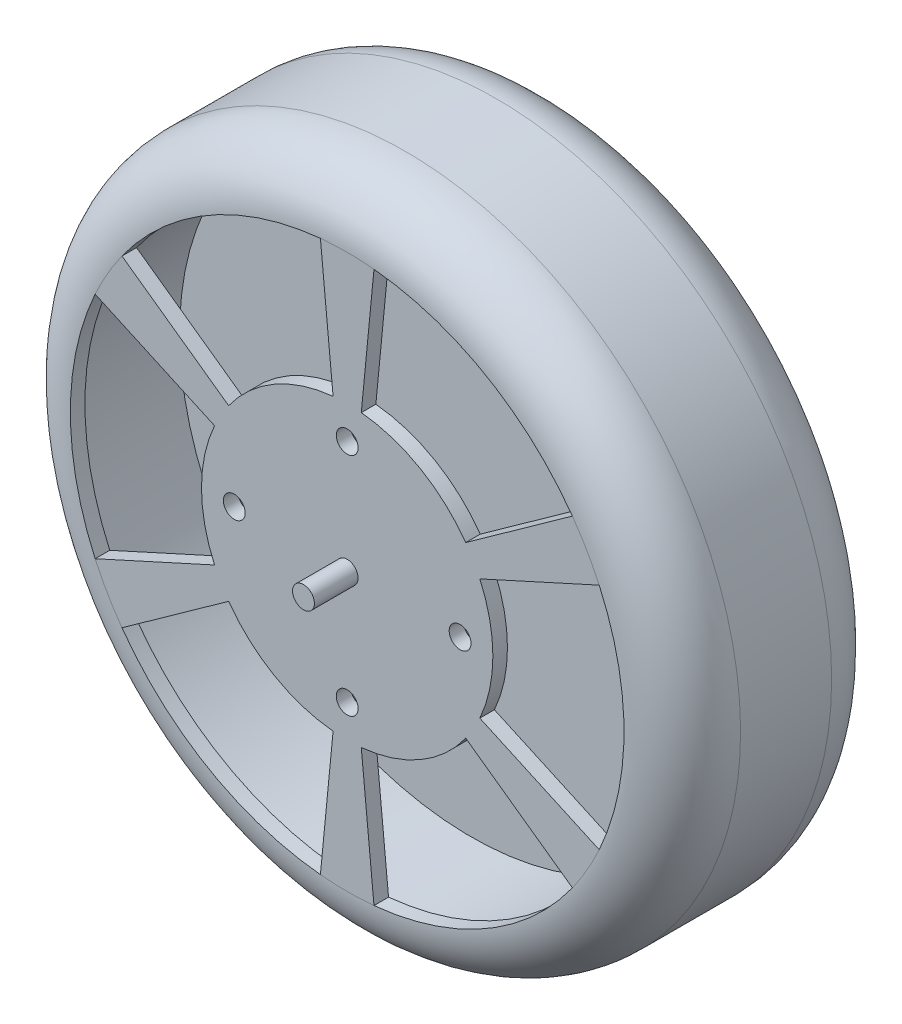
from build123d import *

# Parameters (mm, degrees)
SKETCH_1_R          = 46
EXTRUDE_1_DEPTH     = 28.5
FILLET_1_R          = 8
SKETCH_2_R          = 1.5
CUT_EXTRUDE_1_DEPTH = 4
SKETCH_3_R          = 1.5
EXTRUDE_2_DEPTH     = 6
SKETCH_5_R          = 2
CUT_EXTRUDE_2_DEPTH = 4
CUT_EXTRUDE_3_DEPTH = 12
SKETCH_7_W          = 40
SKETCH_7_H          = 15


with BuildPart() as part:
    # 草图1 → 凸台-拉伸1 (new body)
    with BuildSketch(Plane.XY):
        with Locations(Location((0, 0, 0), (0, 0, 180))):
            Circle(SKETCH_1_R)
    extrude(amount=EXTRUDE_1_DEPTH)

    # 圆角1
    fillet_1_edges = [part.edges().sort_by_distance(p)[0] for p in [
        (46, 0, 0),
        (46, 0, 28.5),
    ]]
    fillet(fillet_1_edges, radius=FILLET_1_R)

    # 草图2 → 切除-拉伸1 (cut)
    with BuildSketch(Plane.XY.offset(28.5)):
        with Locations((0, -15.5)):
            Circle(SKETCH_2_R)
        with Locations((-15.5, 0)):
            Circle(SKETCH_2_R)
        with Locations((0, 15.5)):
            Circle(SKETCH_2_R)
        with Locations((15.5, 0)):
            Circle(SKETCH_2_R)
    extrude(amount=-CUT_EXTRUDE_1_DEPTH, mode=Mode.SUBTRACT)

    # 草图3 → 凸台-拉伸2 (add)
    with BuildSketch(Plane.XY.offset(28.5)):
        Circle(SKETCH_3_R)
    extrude(amount=EXTRUDE_2_DEPTH)

    # 草图5 → 切除-拉伸2 (cut)
    with BuildSketch(Plane(origin=(0, 0, 0), x_dir=(-1, 0, 0), z_dir=(0, 0, -1))):
        with Locations((-20, 0)):
            Circle(SKETCH_5_R)
        with Locations((0, 20)):
            Circle(SKETCH_5_R)
        with Locations((20, 0)):
            Circle(SKETCH_5_R)
        with Locations((0, -20)):
            Circle(SKETCH_5_R)
    extrude(amount=-CUT_EXTRUDE_2_DEPTH, mode=Mode.SUBTRACT)

    # 草图6 → 切除-拉伸3 (cut)
    with BuildSketch(Plane.XY.offset(28.5)):
        with BuildLine():
            Line((-1.935483871, -19.906127252), (-3.677419355, -37.821641779))
            ThreePointArc((-3.677419355, -37.821641779), (-19, -32.908965344), (-30.915792916, -22.095559471))
            Line((-30.915792916, -22.095559471), (-16.271469956, -11.629241827))
            ThreePointArc((-16.271469956, -11.629241827), (-10, -17.320508076), (-1.935483871, -19.906127252))
        make_face()
        with BuildLine():
            Line((1.935483871, -19.906127252), (3.677419355, -37.821641779))
            ThreePointArc((3.677419355, -37.821641779), (19, -32.908965344), (30.915792916, -22.095559471))
            Line((30.915792916, -22.095559471), (16.271469956, -11.629241827))
            ThreePointArc((16.271469956, -11.629241827), (10, -17.320508076), (1.935483871, -19.906127252))
        make_face()
        with BuildLine():
            Line((-18.206953827, -8.276885425), (-34.593212271, -15.726082308))
            ThreePointArc((-34.593212271, -15.726082308), (-38, 0), (-34.593212271, 15.726082308))
            Line((-34.593212271, 15.726082308), (-18.206953827, 8.276885425))
            ThreePointArc((-18.206953827, 8.276885425), (-19.999999876, 0), (-18.206953827, -8.276885425))
        make_face()
        with BuildLine():
            Line((-16.271469956, 11.629241827), (-30.915792916, 22.095559471))
            ThreePointArc((-30.915792916, 22.095559471), (-19, 32.908965344), (-3.677419355, 37.821641779))
            Line((-3.677419355, 37.821641779), (-1.935483871, 19.906127252))
            ThreePointArc((-1.935483871, 19.906127252), (-10, 17.320508076), (-16.271469956, 11.629241827))
        make_face()
        with BuildLine():
            Line((1.935483871, 19.906127252), (3.677419355, 37.821641779))
            ThreePointArc((3.677419355, 37.821641779), (19, 32.908965344), (30.915792916, 22.095559471))
            Line((30.915792916, 22.095559471), (16.271469956, 11.629241827))
            ThreePointArc((16.271469956, 11.629241827), (10, 17.320508076), (1.935483871, 19.906127252))
        make_face()
        with BuildLine():
            Line((18.206953827, 8.276885425), (34.593212271, 15.726082308))
            ThreePointArc((34.593212271, 15.726082308), (38, 0), (34.593212271, -15.726082308))
            Line((34.593212271, -15.726082308), (18.206953827, -8.276885425))
            ThreePointArc((18.206953827, -8.276885425), (20, 0), (18.206953827, 8.276885425))
        make_face()
    extrude(amount=-CUT_EXTRUDE_3_DEPTH, mode=Mode.SUBTRACT)

    # 草图7 → 切除-旋转1 (revolve, cut)
    with BuildSketch(Plane(origin=(0, 0, 0), x_dir=(1, 0, 0), z_dir=(0, 1, 0)), mode=Mode.PRIVATE) as cut_revolve_1_sk:
        with Locations((-20, -19)):
            Rectangle(SKETCH_7_W, SKETCH_7_H)
    revolve(cut_revolve_1_sk.sketch.rotate(Axis((0, 0, 28.5), (0, 0, -1)), 180), axis=Axis((0, 0, 28.5), (0, 0, -1)), mode=Mode.SUBTRACT)


solid = part.part
